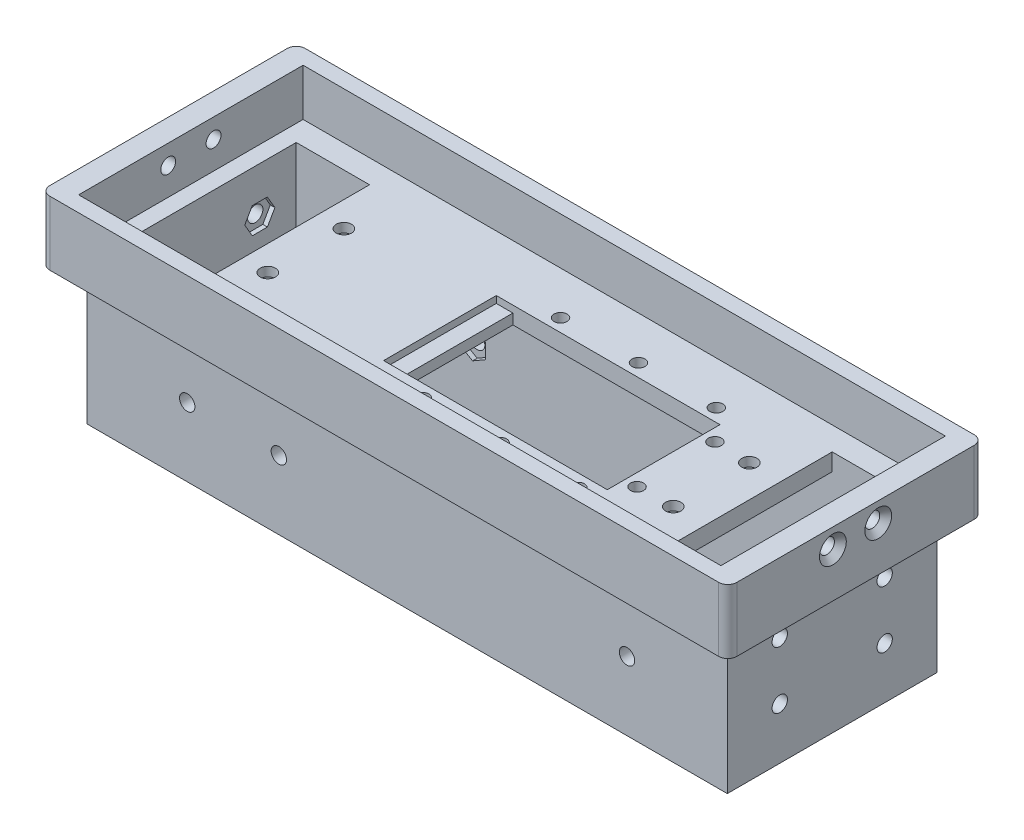
from build123d import *

# Parameters (mm, degrees)
SKETCH_1_W                                = 150
SKETCH_1_H                                = 51.8
SKETCH_1_W_2                              = 140.2
SKETCH_1_H_2                              = 42
EXTRUDE_1_DEPTH                           = 12
SKETCH_2_W                                = 140.2
SKETCH_2_H                                = 42
EXTRUDE_2_DEPTH                           = 2.25
SKETCH_3_W                                = 45.2
SKETCH_3_H                                = 24.6
CUT_EXTRUDE_1_DEPTH                       = 80.942932771
EXTRUDE_5_DEPTH                           = 1.5
SKETCH_9_W                                = 54.37068943
SKETCH_9_H                                = 24.6
EXTRUDE_6_DEPTH                           = 1.5
SKETCH_10_R                               = 1.425
SCREW_HOLES_FOR_CONNECTNG_THE_SERVO_DEPTH = 80.773883571
SKETCH_12_W                               = 140
SKETCH_12_H                               = 45.8
SKETCH_12_W_2                             = 133
SKETCH_12_H_2                             = 38.8
EXTRUDE_9_DEPTH                           = 25
SKETCH_16_W                               = 16
SKETCH_16_H                               = 38.8
CUT_EXTRUDE_4_DEPTH                       = 84.191405806
SKETCH_23_R                               = 1.675
CUT_EXTRUDE_14_DEPTH                      = 150.401506017
SKETCH_49_W                               = 140
SKETCH_49_H                               = 45.8
SKETCH_49_W_2                             = 133
SKETCH_49_H_2                             = 38.8
EXTRUDE_13_DEPTH                          = 5
SKETCH_53_W                               = 45.8
SKETCH_53_H                               = 30
SKETCH_53_R                               = 1.6
CUT_EXTRUDE_19_DEPTH                      = 0.1
SKETCH_59_R                               = 1.675
CUT_EXTRUDE_20_DEPTH                      = 95.37393708
SKETCH_66_R                               = 1.675
CUT_EXTRUDE_21_DEPTH                      = 20
SKETCH_67_W                               = 150
SKETCH_67_H                               = 12
EXTRUDE_15_DEPTH                          = 2
CUT_EXTRUDE_22_REACH                      = 88.847
SKETCH_69_R                               = 1.425
SKETCH_77_W                               = 140.2
SKETCH_77_H                               = 8.25
CUT_EXTRUDE_23_DEPTH                      = 3.5
CUT_EXTRUDE_START                         = -1
SKETCH_82_R                               = 1.675
CUT_EXTRUDE_24_DEPTH                      = 1
SKETCH_83_R                               = 1.675
CUT_EXTRUDE_25_DEPTH                      = 1
SKETCH_93_W                               = 150
SKETCH_93_H                               = 55.8
SKETCH_93_W_2                             = 140.2
SKETCH_93_H_2                             = 49
EXTRUDE_19_DEPTH                          = 2
SKETCH_95_R                               = 1.625
CUT_EXTRUDE_27_DEPTH                      = 156.494083489
CHAMFER_4_SIZE                            = 1.3
CUT_EXTRUDE_START_2                       = -1.75
SKETCH_74_R                               = 1.675
CUT_EXTRUDE_28_DEPTH                      = 1.75
SKETCH_71_R                               = 1.675
CUT_EXTRUDE_29_DEPTH                      = 1.75
FILLET_2_R                                = 2


with BuildPart() as part:
    # 草图1 → 凸台-拉伸1 (new body)
    with BuildSketch(Plane(origin=(0, 0, 0), x_dir=(1, 0, 0), z_dir=(0, 1, 0))):
        Rectangle(SKETCH_1_W, SKETCH_1_H)
        Rectangle(SKETCH_1_W_2, SKETCH_1_H_2, mode=Mode.SUBTRACT)
    extrude(amount=EXTRUDE_1_DEPTH)

    # 草图2 → 凸台-拉伸2 (add)
    with BuildSketch(Plane(origin=(0, 0, 0), x_dir=(1, 0, 0), z_dir=(0, 1, 0))):
        Rectangle(SKETCH_2_W, SKETCH_2_H)
    extrude(amount=EXTRUDE_2_DEPTH)

    # 草图3 → 切除-拉伸1 (cut, through all)
    with BuildSketch(Plane(origin=(0, 2.25, 0), x_dir=(1, 0, 0), z_dir=(0, 1, 0))):
        with Locations((10.5, 0)):
            Rectangle(SKETCH_3_W, SKETCH_3_H)
    extrude(amount=-CUT_EXTRUDE_1_DEPTH, mode=Mode.SUBTRACT)

    # 草图8 → 凸台-拉伸5 (add)
    with BuildSketch(Plane(origin=(0, 2.25, 0), x_dir=(1, 0, 0), z_dir=(0, 1, 0))):
        Polygon((-12.1, -12.3), (33.1, -12.3), (33.1, 12.3), (-70.1, 12.3), (-70.1, 21), (70.1, 21), (70.1, -21), (-70.1, -21), (-70.1, -12.3), align=None)
    extrude(amount=EXTRUDE_5_DEPTH)

    # 草图9 → 凸台-拉伸6 (add)
    with BuildSketch(Plane(origin=(0, 2.25, 0), x_dir=(1, 0, 0), z_dir=(0, 1, 0))):
        with Locations((-42.914655285, 0)):
            Rectangle(SKETCH_9_W, SKETCH_9_H)
    extrude(amount=EXTRUDE_6_DEPTH)

    # 草图10 → Screw_holes_for_connectng_the_servo (cut, through all)
    with BuildSketch(Plane(origin=(0, 3.75, 0), x_dir=(1, 0, 0), z_dir=(0, 1, 0))):
        with Locations((-4.5, 15.1)):
            Circle(SKETCH_10_R)
        with Locations((12.5, 15.1)):
            Circle(SKETCH_10_R)
        with Locations((29.5, 15.1)):
            Circle(SKETCH_10_R)
    screw_holes_for_connectng_the_servo = extrude(amount=-SCREW_HOLES_FOR_CONNECTNG_THE_SERVO_DEPTH, mode=Mode.SUBTRACT)

    # Screw_holes_for_connectng_the_servo(2): Screw_holes_for_connectng_the_servo across plane
    add(screw_holes_for_connectng_the_servo.mirror(Plane.XY), mode=Mode.SUBTRACT)

    # 草图12 → 凸台-拉伸9 (add)
    with BuildSketch(Plane(origin=(0, 0, 0), x_dir=(-1, 0, 0), z_dir=(0, -1, 0))):
        Rectangle(SKETCH_12_W, SKETCH_12_H)
        Rectangle(SKETCH_12_W_2, SKETCH_12_H_2, mode=Mode.SUBTRACT)
    extrude(amount=EXTRUDE_9_DEPTH)

    # 草图16 → 切除-拉伸4 (cut, through all)
    with BuildSketch(Plane(origin=(0, 0, 0), x_dir=(-1, 0, 0), z_dir=(0, -1, 0))):
        Polygon((-66.5, 19.4), (-66.5, -19.9), (-50.5, -19.4), (-50.5, 19.4), align=None)
        with Locations((58.5, 0)):
            Rectangle(SKETCH_16_W, SKETCH_16_H)
    extrude(amount=-CUT_EXTRUDE_4_DEPTH, mode=Mode.SUBTRACT)

    # 草图23 → 切除-拉伸14 (cut, through all)
    with BuildSketch(Plane(origin=(70, 0, 0), x_dir=(0, 0, -1), z_dir=(1, 0, 0))):
        with Locations((-11.45, -6.25)):
            Circle(SKETCH_23_R)
        with Locations((11.45, -6.25)):
            Circle(SKETCH_23_R)
        with Locations((11.45, -18.75)):
            Circle(SKETCH_23_R)
        with Locations((-11.45, -18.75)):
            Circle(SKETCH_23_R)
    extrude(amount=-CUT_EXTRUDE_14_DEPTH, mode=Mode.SUBTRACT)

    # 草图49 → 凸台-拉伸13 (add)
    with BuildSketch(Plane(origin=(0, -25, 0), x_dir=(-1, 0, 0), z_dir=(0, -1, 0))):
        Rectangle(SKETCH_49_W, SKETCH_49_H)
        Rectangle(SKETCH_49_W_2, SKETCH_49_H_2, mode=Mode.SUBTRACT)
    extrude(amount=EXTRUDE_13_DEPTH)

    # 草图53 → 切除-拉伸19 (cut)
    with BuildSketch(Plane(origin=(70, 0, 0), x_dir=(0, 0, -1), z_dir=(1, 0, 0))):
        with Locations((0, -15)):
            Rectangle(SKETCH_53_W, SKETCH_53_H)
        with Locations((-11.45, -6.25)):
            Circle(SKETCH_53_R, mode=Mode.SUBTRACT)
        with Locations((-11.45, -18.75)):
            Circle(SKETCH_53_R, mode=Mode.SUBTRACT)
        with Locations((11.45, -18.75)):
            Circle(SKETCH_53_R, mode=Mode.SUBTRACT)
        with Locations((11.45, -6.25)):
            Circle(SKETCH_53_R, mode=Mode.SUBTRACT)
    cut_extrude_19 = extrude(amount=-CUT_EXTRUDE_19_DEPTH, mode=Mode.SUBTRACT)

    # 镜向7: 切除-拉伸19 across plane
    add(cut_extrude_19.mirror(Plane(origin=(0, 0, 0), x_dir=(0, 0, 1), z_dir=(1, 0, 0))), mode=Mode.SUBTRACT)

    # 草图59 → 切除-拉伸20 (cut, through all)
    with BuildSketch(Plane(origin=(0, 0, -22.9), x_dir=(-1, 0, 0), z_dir=(0, 0, -1))):
        with Locations((-48, -15)):
            Circle(SKETCH_59_R)
        with Locations((28, -15)):
            Circle(SKETCH_59_R)
        with Locations((48, -15)):
            Circle(SKETCH_59_R)
    extrude(amount=-CUT_EXTRUDE_20_DEPTH, mode=Mode.SUBTRACT)

    # 草图66 → 切除-拉伸21 (cut)
    with BuildSketch(Plane(origin=(0, 3.75, 0), x_dir=(1, 0, 0), z_dir=(0, 1, 0))):
        with Locations((43.5, -8.3)):
            Circle(SKETCH_66_R)
        with Locations((43.5, 8.3)):
            Circle(SKETCH_66_R)
        with Locations((-45, 8.3)):
            Circle(SKETCH_66_R)
        with Locations((-45, -8.3)):
            Circle(SKETCH_66_R)
    extrude(amount=-CUT_EXTRUDE_21_DEPTH, mode=Mode.SUBTRACT)

    # 草图67 → 凸台-拉伸15 (add)
    with BuildSketch(Plane(origin=(0, 0, -25.9), x_dir=(-1, 0, 0), z_dir=(0, 0, -1))):
        with Locations((0, 6)):
            Rectangle(SKETCH_67_W, SKETCH_67_H)
    extrude_15 = extrude(amount=EXTRUDE_15_DEPTH)

    # 镜向10: 凸台-拉伸15 across plane
    add(extrude_15.mirror(Plane.XY))

    # 草图69 → 切除-拉伸22 (cut, up to next)
    with BuildSketch(Plane(origin=(0, 3.75, 0), x_dir=(1, 0, 0), z_dir=(0, 1, 0)), mode=Mode.PRIVATE) as cut_extrude_22_sk1:
        with Locations((35.8, 8.5)):
            Circle(SKETCH_69_R)
    cut_extrude_22_tool1 = extrude(cut_extrude_22_sk1.sketch, amount=-CUT_EXTRUDE_22_REACH, mode=Mode.PRIVATE) & part.part
    # 草图69 → 切除-拉伸22 (cut, up to next)
    with BuildSketch(Plane(origin=(0, 3.75, 0), x_dir=(1, 0, 0), z_dir=(0, 1, 0)), mode=Mode.PRIVATE) as cut_extrude_22_sk2:
        with Locations((35.8, -8.5)):
            Circle(SKETCH_69_R)
    cut_extrude_22_tool2 = extrude(cut_extrude_22_sk2.sketch, amount=-CUT_EXTRUDE_22_REACH, mode=Mode.PRIVATE) & part.part
    add(cut_extrude_22_tool1.solids().sort_by_distance((35.8, 3.75, -8.5))[0], mode=Mode.SUBTRACT)
    add(cut_extrude_22_tool2.solids().sort_by_distance((35.8, 3.75, 8.5))[0], mode=Mode.SUBTRACT)

    # 草图77 → 切除-拉伸23 (cut)
    with BuildSketch(Plane.XY.offset(-21)):
        with Locations((0, 7.875)):
            Rectangle(SKETCH_77_W, SKETCH_77_H)
    cut_extrude_23 = extrude(amount=-CUT_EXTRUDE_23_DEPTH, mode=Mode.SUBTRACT)

    # 镜向13: 切除-拉伸23 across plane
    add(cut_extrude_23.mirror(Plane.XY), mode=Mode.SUBTRACT)

    # 草图82 → 切除-拉伸24 (cut)
    # profile 1 of 4: a face of its own
    with BuildSketch(Plane.ZY.offset(-66.5).offset(CUT_EXTRUDE_START)):
        Polygon((-9.817108297, -9.107212748), (-8.159135325, -6.264480678), (-9.792027028, -3.40726793), (-13.082891703, -3.392787252), (-14.740864675, -6.235519322), (-13.107972972, -9.09273207), align=None)
        with Locations((-11.45, -6.25)):
            Circle(SKETCH_82_R, mode=Mode.SUBTRACT)
    # profile 2 of 4: a face of its own
    with BuildSketch(Plane.ZY.offset(-66.5).offset(CUT_EXTRUDE_START)):
        Polygon((13.082891703, -9.107212748), (14.740864675, -6.264480678), (13.107972972, -3.40726793), (9.817108297, -3.392787252), (8.159135325, -6.235519322), (9.792027028, -9.09273207), align=None)
        with Locations((11.45, -6.25)):
            Circle(SKETCH_82_R, mode=Mode.SUBTRACT)
    # profile 3 of 4: a face of its own
    with BuildSketch(Plane.ZY.offset(-66.5).offset(CUT_EXTRUDE_START)):
        Polygon((9.812330408, -15.895523111), (8.159115704, -18.741025025), (9.796785296, -21.595501914), (13.087669592, -21.604476889), (14.740884296, -18.758974975), (13.103214704, -15.904498086), align=None)
        with Locations((11.45, -18.75)):
            Circle(SKETCH_82_R, mode=Mode.SUBTRACT)
    # profile 4 of 4: a face of its own
    with BuildSketch(Plane.ZY.offset(-66.5).offset(CUT_EXTRUDE_START)):
        Polygon((-9.808448759, -21.6022464), (-8.15910654, -18.754498124), (-9.80065778, -15.902251724), (-13.091551241, -15.8977536), (-14.74089346, -18.745501876), (-13.09934222, -21.597748276), align=None)
        with Locations((-11.45, -18.75)):
            Circle(SKETCH_82_R, mode=Mode.SUBTRACT)
    cut_extrude_24 = extrude(amount=CUT_EXTRUDE_24_DEPTH, mode=Mode.SUBTRACT)

    # 镜向14: 切除-拉伸24 across plane
    add(cut_extrude_24.mirror(Plane(origin=(0, 0, 0), x_dir=(0, 0, 1), z_dir=(1, 0, 0))), mode=Mode.SUBTRACT)

    # 草图83 → 切除-拉伸25 (cut)
    # profile 1 of 3: a face of its own
    with BuildSketch(Plane(origin=(0, 0, 19.4), x_dir=(-1, 0, 0), z_dir=(0, 0, -1))):
        Polygon((48, -11.709103466), (45.15, -13.354551733), (45.15, -16.645448267), (48, -18.290896534), (50.85, -16.645448267), (50.85, -13.354551733), align=None)
        with Locations((48, -15)):
            Circle(SKETCH_83_R, mode=Mode.SUBTRACT)
    # profile 2 of 3: a face of its own
    with BuildSketch(Plane(origin=(0, 0, 19.4), x_dir=(-1, 0, 0), z_dir=(0, 0, -1))):
        Polygon((28, -11.709103466), (25.15, -13.354551733), (25.15, -16.645448267), (28, -18.290896534), (30.85, -16.645448267), (30.85, -13.354551733), align=None)
        with Locations((28, -15)):
            Circle(SKETCH_83_R, mode=Mode.SUBTRACT)
    # profile 3 of 3: a face of its own
    with BuildSketch(Plane(origin=(0, 0, 19.4), x_dir=(-1, 0, 0), z_dir=(0, 0, -1))):
        Polygon((-48, -11.709103466), (-50.85, -13.354551733), (-50.85, -16.645448267), (-48, -18.290896534), (-45.15, -16.645448267), (-45.15, -13.354551733), align=None)
        with Locations((-48, -15)):
            Circle(SKETCH_83_R, mode=Mode.SUBTRACT)
    cut_extrude_25 = extrude(amount=-CUT_EXTRUDE_25_DEPTH, mode=Mode.SUBTRACT)

    # 镜向15: 切除-拉伸25 across plane
    add(cut_extrude_25.mirror(Plane.XY), mode=Mode.SUBTRACT)

    # 草图93 → 凸台-拉伸19 (add)
    with BuildSketch(Plane(origin=(0, 12, 0), x_dir=(1, 0, 0), z_dir=(0, 1, 0))):
        Rectangle(SKETCH_93_W, SKETCH_93_H)
        Rectangle(SKETCH_93_W_2, SKETCH_93_H_2, mode=Mode.SUBTRACT)
    extrude(amount=EXTRUDE_19_DEPTH)

    # 草图95 → 切除-拉伸27 (cut, through all)
    with BuildSketch(Plane(origin=(75, 0, 0), x_dir=(0, 0, -1), z_dir=(1, 0, 0))):
        with Locations((-4.95, 9.75)):
            Circle(SKETCH_95_R)
        with Locations((4.95, 9.75)):
            Circle(SKETCH_95_R)
    extrude(amount=-CUT_EXTRUDE_27_DEPTH, mode=Mode.SUBTRACT)

    # 倒角4
    chamfer_4_edges = [part.edges().sort_by_distance(p)[0] for p in [
        (-75, 9.75, -3.325),
        (-75, 9.75, 6.575),
        (75, 9.75, 6.575),
        (75, 9.75, -3.325),
    ]]
    chamfer(chamfer_4_edges, length=CHAMFER_4_SIZE)

    # 草图74 → 切除-拉伸28 (cut)
    with BuildSketch(Plane(origin=(0, 0, 0), x_dir=(-1, 0, 0), z_dir=(0, -1, 0)).offset(CUT_EXTRUDE_START_2)):
        Polygon((47.85, -6.654551733), (45, -5.009103466), (42.15, -6.654551733), (42.15, -9.945448267), (45, -11.590896534), (47.85, -9.945448267), align=None)
        with Locations((45, -8.3)):
            Circle(SKETCH_74_R, mode=Mode.SUBTRACT)
    cut_extrude_28 = extrude(amount=CUT_EXTRUDE_28_DEPTH, mode=Mode.SUBTRACT)

    # 草图71 → 切除-拉伸29 (cut)
    with BuildSketch(Plane(origin=(0, 0, 0), x_dir=(-1, 0, 0), z_dir=(0, -1, 0)).offset(CUT_EXTRUDE_START_2)):
        Polygon((-40.65, -6.654551733), (-43.5, -5.009103466), (-46.35, -6.654551733), (-46.35, -9.945448267), (-43.5, -11.590896534), (-40.65, -9.945448267), align=None)
        with Locations((-43.5, -8.3)):
            Circle(SKETCH_71_R, mode=Mode.SUBTRACT)
    cut_extrude_29 = extrude(amount=CUT_EXTRUDE_29_DEPTH, mode=Mode.SUBTRACT)

    # 镜向16: 切除-拉伸28, 切除-拉伸29 across plane
    add(cut_extrude_28.mirror(Plane.XY), mode=Mode.SUBTRACT)
    add(cut_extrude_29.mirror(Plane.XY), mode=Mode.SUBTRACT)

    # 圆角2
    fillet_2_edges = [part.edges().sort_by_distance(p)[0] for p in [
        (-75, 7, -27.9),
        (-75, 7, 27.9),
        (75, 7, 27.9),
        (75, 7, -27.9),
    ]]
    fillet(fillet_2_edges, radius=FILLET_2_R)


solid = part.part
